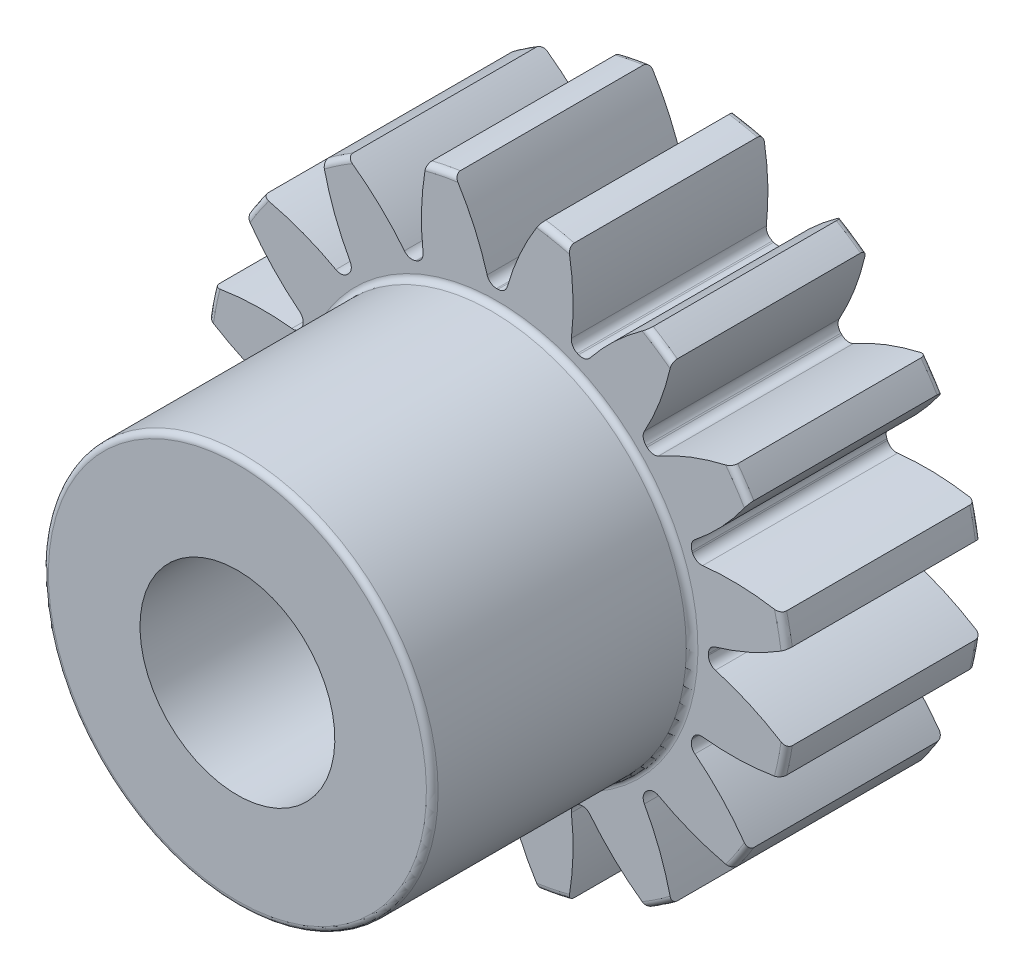
from build123d import *

# Parameters (mm, degrees)
FILLET2_R          = 0.09
CUT_EXTRUDE2_DEPTH = 8.516648309
CIRPATTERN1_COUNT  = 16


with BuildPart() as part:
    # Sketch4 → Revolve1 (revolve)
    with BuildSketch(Plane(origin=(0, 0, 0), x_dir=(0, 0, -1), z_dir=(1, 0, 0))):
        Polygon((-7, 1.5), (-7, 3), (-3, 3), (-3, 4.5), (0, 4.5), (0, 1.5), align=None)
    revolve(axis=Axis((0, 0, 3), (0, 0, 1)))

    # Fillet2
    fillet2_edges = [part.edges().sort_by_distance(p)[0] for p in [
        (0, -4.5, 0),
        (0, -4.5, 3),
        (0, -3, 3),
        (0, -3, 7),
    ]]
    fillet(fillet2_edges, radius=FILLET2_R)

    # Sketch7 → Cut-Extrude2 (cut, through all)
    with BuildSketch(Plane.XY.offset(3)):
        with BuildLine():
            ThreePointArc((-0.010431737, 3.249983258), (0, 3.25), (0.010431737, 3.249983258))
            ThreePointArc((0.010431737, 3.249983258), (0.100920367, 3.279985103), (0.1550582, 3.358454192))
            ThreePointArc((0.1550582, 3.358454192), (0.365420722, 3.924049407), (0.658473212, 4.451562987))
            ThreePointArc((0.658473212, 4.451562987), (0, 4.5), (-0.658473212, 4.451562987))
            ThreePointArc((-0.658473212, 4.451562987), (-0.365420722, 3.924049407), (-0.1550582, 3.358454192))
            ThreePointArc((-0.1550582, 3.358454192), (-0.100920367, 3.279985103), (-0.010431737, 3.249983258))
        make_face()
    cut_extrude2 = extrude(amount=-CUT_EXTRUDE2_DEPTH, mode=Mode.SUBTRACT)

    # CirPattern1: Cut-Extrude2 ×16 about axis
    cirpattern1_axis = Axis((0, 0, 0), (0, 0, 1))
    for i in range(1, CIRPATTERN1_COUNT):
        add(cut_extrude2.rotate(cirpattern1_axis, i * 360 / CIRPATTERN1_COUNT), mode=Mode.SUBTRACT)


solid = part.part
